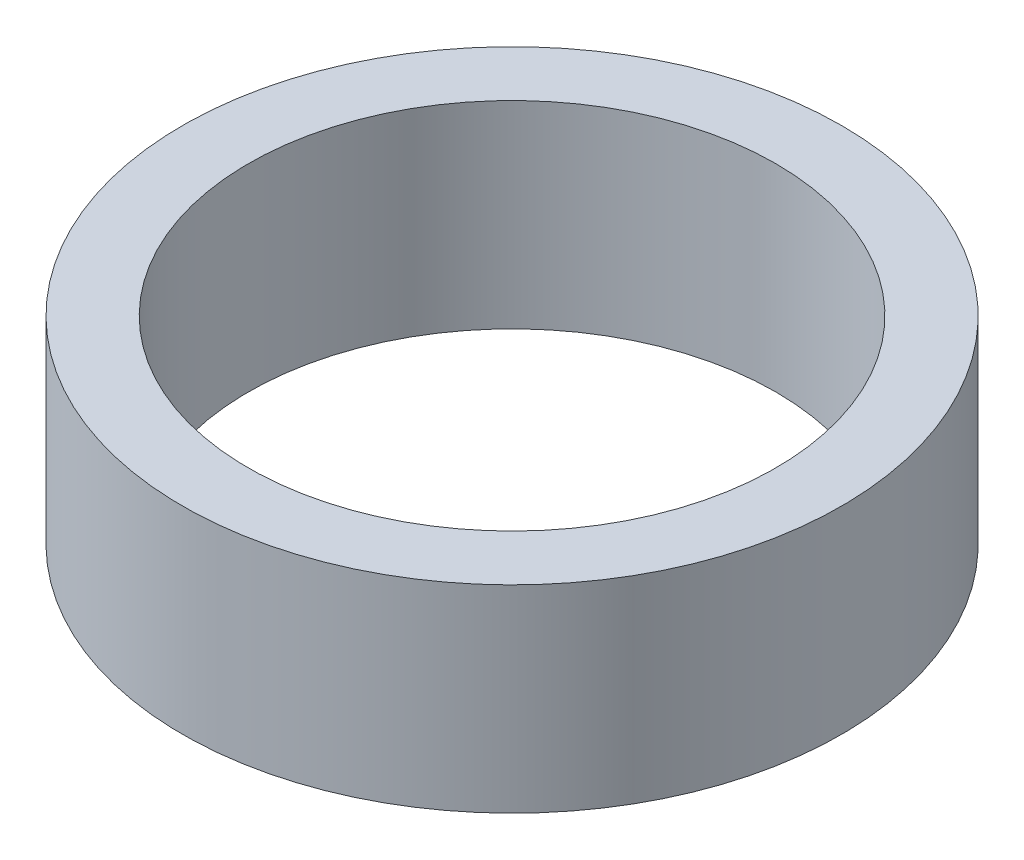
from build123d import *

# Parameters (mm, degrees)
SKETCH1_R           = 15.875
SKETCH1_R_2         = 12.7
BOSS_EXTRUDE1_DEPTH = 9.525


with BuildPart() as part:
    # Sketch1 → Boss-Extrude1 (new body)
    with BuildSketch(Plane(origin=(0, 0, 0), x_dir=(1, 0, 0), z_dir=(0, 1, 0))):
        with Locations(Location((0, 0, 0), (0, 0, 90))):
            Circle(SKETCH1_R)
        with Locations(Location((0, 0, 0), (0, 0, 90))):
            Circle(SKETCH1_R_2, mode=Mode.SUBTRACT)
    extrude(amount=BOSS_EXTRUDE1_DEPTH)


solid = part.part
